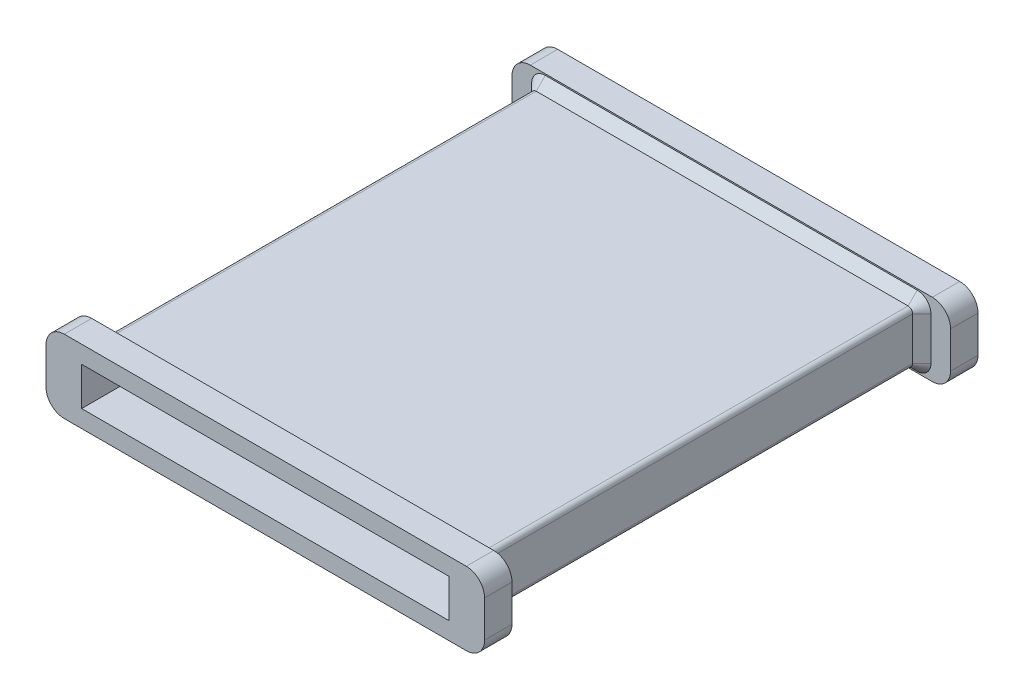
from build123d import *

# Parameters (mm, degrees)
SKETCH1_W           = 48
SKETCH1_H           = 8
SKETCH1_W_2         = 40.2
SKETCH1_H_2         = 4.2
BOSS_EXTRUDE1_DEPTH = 54
CUT_EXTRUDE1_START  = -3
SKETCH2_OUTSIDE_W   = 64.538
SKETCH2_OUTSIDE_H   = 24.538
CUT_EXTRUDE1_DEPTH  = 48
FILLET1_R           = 2
CHAMFER1_SIZE       = 1


with BuildPart() as part:
    # Sketch1 → Boss-Extrude1 (new body)
    with BuildSketch(Plane.XY):
        with Locations((24, 4)):
            Rectangle(SKETCH1_W, SKETCH1_H)
        with Locations((24, 4)):
            Rectangle(SKETCH1_W_2, SKETCH1_H_2, mode=Mode.SUBTRACT)
    extrude(amount=BOSS_EXTRUDE1_DEPTH)

    # Sketch2 outside → Cut-Extrude1 (cut)
    with BuildSketch(Plane.XY.offset(54).offset(CUT_EXTRUDE1_START)):
        with Locations((24, 4)):
            Rectangle(SKETCH2_OUTSIDE_W, SKETCH2_OUTSIDE_H)
        with BuildLine():
            Line((3.65, 6.85), (44.35, 6.85))
            ThreePointArc((44.35, 6.85), (44.703553391, 6.703553391), (44.85, 6.35))
            Line((44.85, 6.35), (44.85, 1.65))
            ThreePointArc((44.85, 1.65), (44.703553391, 1.296446609), (44.35, 1.15))
            Line((44.35, 1.15), (3.65, 1.15))
            ThreePointArc((3.65, 1.15), (3.296446609, 1.296446609), (3.15, 1.65))
            Line((3.15, 1.65), (3.15, 6.35))
            ThreePointArc((3.15, 6.35), (3.296446609, 6.703553391), (3.65, 6.85))
        make_face(mode=Mode.SUBTRACT)
    extrude(amount=-CUT_EXTRUDE1_DEPTH, mode=Mode.SUBTRACT)

    # Fillet1
    fillet1_edges = [part.edges().sort_by_distance(p)[0] for p in [
        (48, 0, 1.5),
        (0, 0, 1.5),
        (0, 8, 1.5),
        (48, 8, 1.5),
        (48, 0, 52.5),
        (0, 0, 52.5),
        (0, 8, 52.5),
        (48, 8, 52.5),
    ]]
    fillet(fillet1_edges, radius=FILLET1_R)

    # Chamfer1
    chamfer1_edges = [part.edges().sort_by_distance(p)[0] for p in [
        (3.15, 4, 3),
        (3.296446609, 1.296446609, 3),
        (24, 1.15, 3),
        (44.703553391, 1.296446609, 3),
        (44.85, 4, 3),
        (44.703553391, 6.703553391, 3),
        (24, 6.85, 3),
        (3.296446609, 6.703553391, 3),
        (3.296446609, 1.296446609, 51),
        (3.15, 4, 51),
        (3.296446609, 6.703553391, 51),
        (24, 6.85, 51),
        (44.703553391, 6.703553391, 51),
        (44.85, 4, 51),
        (44.703553391, 1.296446609, 51),
        (24, 1.15, 51),
    ]]
    chamfer(chamfer1_edges, length=CHAMFER1_SIZE)


solid = part.part
